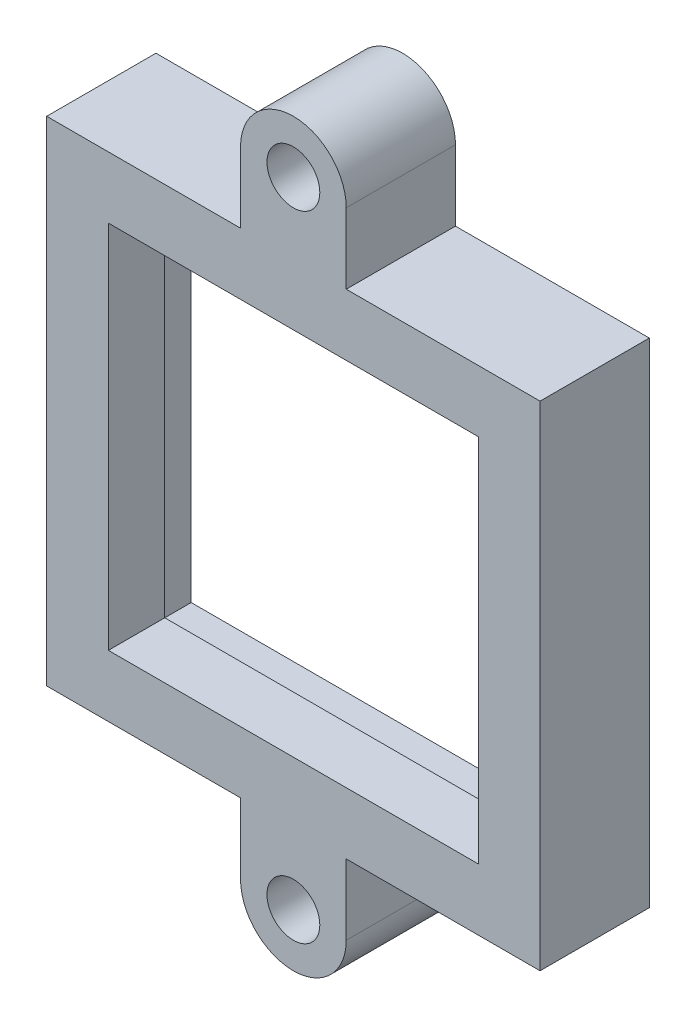
from build123d import *

# Parameters (mm, degrees)
SKETCH_1_W          = 14
SKETCH_1_H          = 14
SKETCH_1_W_2        = 12
SKETCH_1_H_2        = 12
EXTRUDE_1_DEPTH     = 1.5
SKETCH_2_W          = 3
SKETCH_2_H          = 1.5
EXTRUDE_2_DEPTH     = 3.5
SKETCH_3_R          = 0.75
CUT_EXTRUDE_1_DEPTH = 3.5
CUT_EXTRUDE_2_DEPTH = 3.5
EXTRUDE_START       = 1.6
SKETCH_6_R          = 0.75
SKETCH_6_W          = 10.5
SKETCH_6_H          = 10.5
EXTRUDE_3_DEPTH     = 1.6


with BuildPart() as part:
    # 草图1 → 凸台-拉伸1 (new body)
    with BuildSketch(Plane.XY):
        Rectangle(SKETCH_1_W, SKETCH_1_H)
        Rectangle(SKETCH_1_W_2, SKETCH_1_H_2, mode=Mode.SUBTRACT)
    extrude(amount=EXTRUDE_1_DEPTH)

    # 草图2 → 凸台-拉伸2 (add)
    with BuildSketch(Plane.XZ.offset(7)):
        with Locations((0, 0.75)):
            Rectangle(SKETCH_2_W, SKETCH_2_H)
    extrude_2 = extrude(amount=EXTRUDE_2_DEPTH)

    # 草图3 → 切除-拉伸1 (cut)
    with BuildSketch(Plane.XY.offset(1.5)):
        with Locations((0, -9)):
            Circle(SKETCH_3_R)
    cut_extrude_1 = extrude(amount=-CUT_EXTRUDE_1_DEPTH, mode=Mode.SUBTRACT)

    # 草图3<3> → 切除-拉伸2 (cut)
    with BuildSketch(Plane.XY.offset(1.5)):
        with BuildLine():
            ThreePointArc((0, -10.5), (-1.060660172, -10.060660172), (-1.5, -9))
            Line((-1.5, -9), (-1.5, -10.5))
            Line((-1.5, -10.5), (0, -10.5))
        make_face()
        with BuildLine():
            Line((1.5, -10.5), (1.5, -9))
            ThreePointArc((1.5, -9), (1.060660172, -10.060660172), (0, -10.5))
            Line((0, -10.5), (1.5, -10.5))
        make_face()
    cut_extrude_2 = extrude(amount=-CUT_EXTRUDE_2_DEPTH, mode=Mode.SUBTRACT)

    # 镜向1: 凸台-拉伸2, 切除-拉伸1, 切除-拉伸2 across plane
    add(extrude_2.mirror(Plane.ZX))
    add(cut_extrude_1.mirror(Plane.ZX), mode=Mode.SUBTRACT)
    add(cut_extrude_2.mirror(Plane.ZX), mode=Mode.SUBTRACT)

    # 草图6 → 凸台-拉伸3 (add)
    with BuildSketch(Plane.XY.offset(1.5).offset(EXTRUDE_START)):
        with BuildLine():
            Line((-1.5, -9), (-1.5, -7))
            Line((-1.5, -7), (-7, -7))
            Line((-7, -7), (-7, 7))
            Line((-7, 7), (-1.5, 7))
            Line((-1.5, 7), (-1.5, 9))
            ThreePointArc((-1.5, 9), (0, 10.5), (1.5, 9))
            Line((1.5, 9), (1.5, 7))
            Line((1.5, 7), (7, 7))
            Line((7, 7), (7, -7))
            Line((7, -7), (1.5, -7))
            Line((1.5, -7), (1.5, -9))
            ThreePointArc((1.5, -9), (0, -10.5), (-1.5, -9))
        make_face()
        with Locations((0, 9)):
            Circle(SKETCH_6_R, mode=Mode.SUBTRACT)
        with Locations((0, -9)):
            Circle(SKETCH_6_R, mode=Mode.SUBTRACT)
        Rectangle(SKETCH_6_W, SKETCH_6_H, mode=Mode.SUBTRACT)
    extrude(amount=-EXTRUDE_3_DEPTH)


solid = part.part
